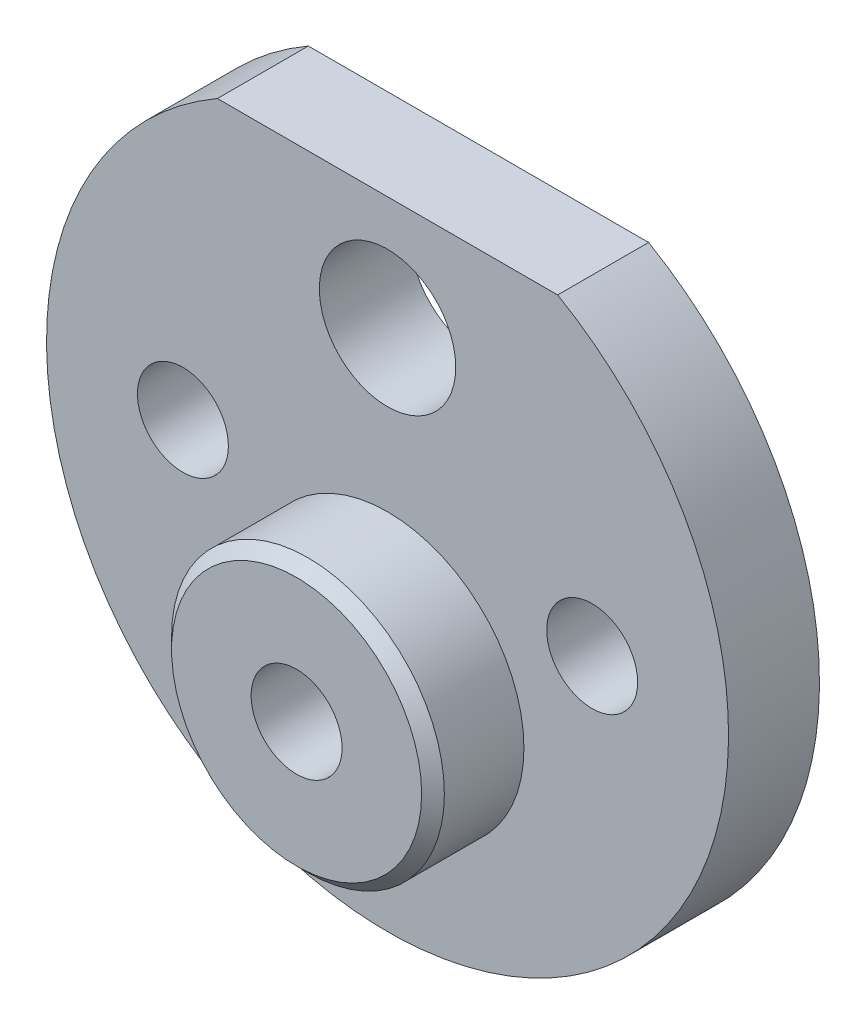
from build123d import *

# Parameters (mm, degrees)
SKETCH1_R           = 2
SKETCH1_R_2         = 3
BOSS_EXTRUDE1_DEPTH = 4
SKETCH2_R           = 6
BOSS_EXTRUDE2_DEPTH = 4
SKETCH3_R           = 2
CUT_EXTRUDE1_DEPTH  = 23.671568098
CHAMFER1_SIZE       = 0.5


with BuildPart() as part:
    # Sketch1 → Boss-Extrude1 (new body)
    with BuildSketch(Plane.XY):
        with BuildLine():
            Line((-7.483314774, 13), (7.483314774, 13))
            ThreePointArc((7.483314774, 13), (0, -15), (-7.483314774, 13))
        make_face()
        with Locations((-9, 0)):
            Circle(SKETCH1_R, mode=Mode.SUBTRACT)
        with Locations((0, 8)):
            Circle(SKETCH1_R_2, mode=Mode.SUBTRACT)
        with Locations((9, 0)):
            Circle(SKETCH1_R, mode=Mode.SUBTRACT)
    extrude(amount=BOSS_EXTRUDE1_DEPTH)

    # Sketch2 → Boss-Extrude2 (add)
    with BuildSketch(Plane.XY.offset(4)):
        with Locations((0, -5)):
            Circle(SKETCH2_R)
    extrude(amount=BOSS_EXTRUDE2_DEPTH)

    # Sketch3 → Cut-Extrude1 (cut, through all)
    with BuildSketch(Plane.XY.offset(8)):
        with Locations((0, -5)):
            Circle(SKETCH3_R)
    extrude(amount=-CUT_EXTRUDE1_DEPTH, mode=Mode.SUBTRACT)

    # Chamfer1
    chamfer1_edges = [part.edges().sort_by_distance(p)[0] for p in [
        (-6, -5, 8),
    ]]
    chamfer(chamfer1_edges, length=CHAMFER1_SIZE)


solid = part.part
